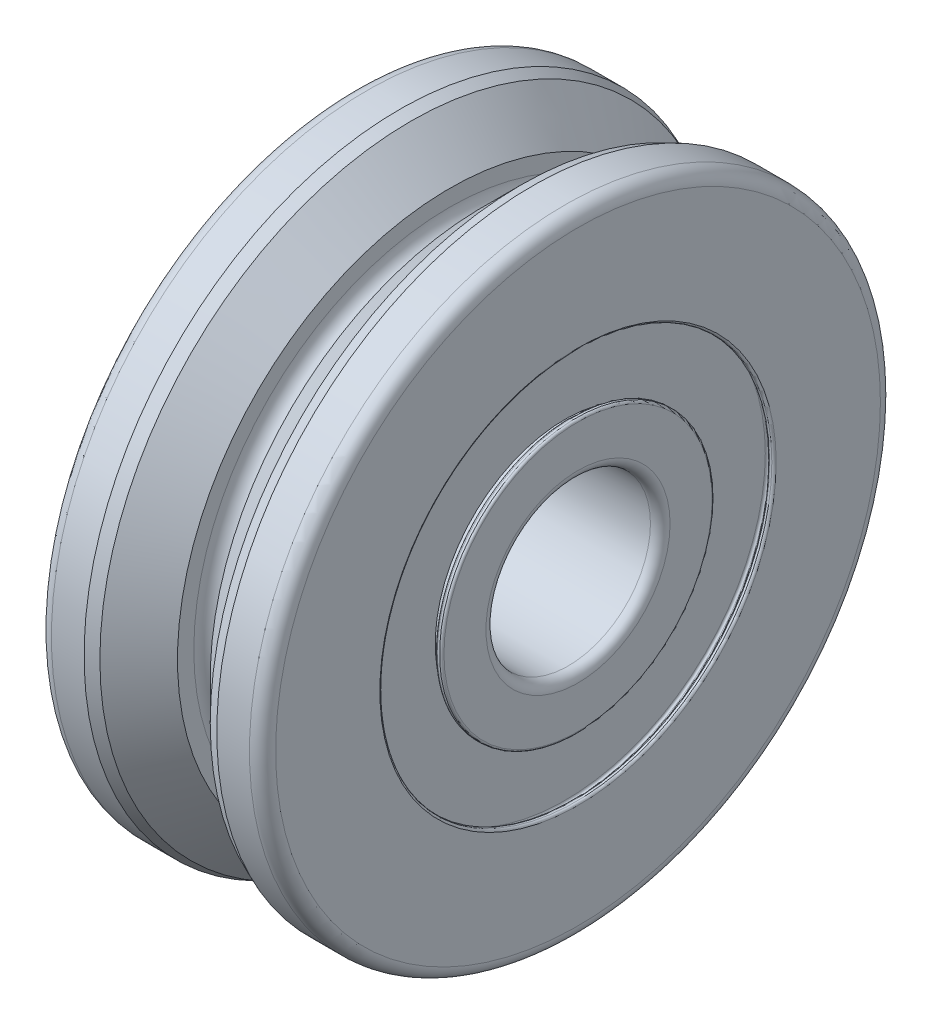
from build123d import *


with BuildPart() as part:
    # Sketch1 → Revolve1 (revolve)
    with BuildSketch(Plane.XY, mode=Mode.PRIVATE) as revolve1_sk:
        with BuildLine():
            Line((-3.4798, 4.161366666), (-3.4798, 2.8575))
            ThreePointArc((-3.4798, 2.8575), (-3.390526147, 2.641973853), (-3.175, 2.5527))
            Line((-3.175, 2.5527), (3.175, 2.5527))
            ThreePointArc((3.175, 2.5527), (3.390526147, 2.641973853), (3.4798, 2.8575))
            Line((3.4798, 2.8575), (3.4798, 4.161366666))
            ThreePointArc((3.4798, 4.161366666), (3.459961366, 4.209261365), (3.412066666, 4.2291))
            Line((3.412066666, 4.2291), (3.344333334, 4.2291))
            ThreePointArc((3.344333334, 4.2291), (3.296438634, 4.209261365), (3.2766, 4.161366666))
            Line((3.2766, 4.161366666), (3.2766, 4.0259))
            Line((3.2766, 4.0259), (3.0734, 4.0259))
            Line((3.0734, 4.0259), (3.0734, 6.218766666))
            ThreePointArc((3.0734, 6.218766666), (3.093238635, 6.266661366), (3.141133334, 6.2865))
            Line((3.141133334, 6.2865), (3.2766, 6.2865))
            Line((3.2766, 6.2865), (3.2766, 6.151033334))
            ThreePointArc((3.2766, 6.151033334), (3.296438634, 6.103138634), (3.344333334, 6.0833))
            Line((3.344333334, 6.0833), (3.412066666, 6.0833))
            ThreePointArc((3.412066666, 6.0833), (3.459961366, 6.103138634), (3.4798, 6.151033334))
            Line((3.4798, 6.151033334), (3.4798, 9.3853))
            ThreePointArc((3.4798, 9.3853), (3.360768196, 9.672668196), (3.0734, 9.7917))
            Line((3.0734, 9.7917), (2.059346048, 9.7917))
            Line((2.059346048, 9.7917), (1.71246195, 9.648015903))
            Line((1.71246195, 9.648015903), (0.507999999, 8.443553952))
            Line((0.507999999, 8.443553952), (0.507999999, 7.937500001))
            ThreePointArc((0.507999999, 7.937500001), (0, 7.429500002), (-0.507999999, 7.937500001))
            Line((-0.507999999, 7.937500001), (-0.507999999, 8.443553952))
            Line((-0.507999999, 8.443553952), (-1.71246195, 9.648015903))
            Line((-1.71246195, 9.648015903), (-2.059346048, 9.7917))
            Line((-2.059346048, 9.7917), (-3.0734, 9.7917))
            ThreePointArc((-3.0734, 9.7917), (-3.360768196, 9.672668196), (-3.4798, 9.3853))
            Line((-3.4798, 9.3853), (-3.4798, 6.151033334))
            ThreePointArc((-3.4798, 6.151033334), (-3.459961366, 6.103138634), (-3.412066666, 6.0833))
            Line((-3.412066666, 6.0833), (-3.344333333, 6.0833))
            ThreePointArc((-3.344333333, 6.0833), (-3.296438633, 6.103138634), (-3.276599999, 6.151033334))
            Line((-3.276599999, 6.151033334), (-3.276599999, 6.2865))
            Line((-3.276599999, 6.2865), (-3.141133332, 6.2865))
            ThreePointArc((-3.141133332, 6.2865), (-3.093238633, 6.266661366), (-3.073399999, 6.218766666))
            Line((-3.073399999, 6.218766666), (-3.073399999, 4.0259))
            Line((-3.073399999, 4.0259), (-3.276599999, 4.0259))
            Line((-3.276599999, 4.0259), (-3.276599999, 4.161366666))
            ThreePointArc((-3.276599999, 4.161366666), (-3.296438633, 4.209261365), (-3.344333333, 4.2291))
            Line((-3.344333333, 4.2291), (-3.412066666, 4.2291))
            ThreePointArc((-3.412066666, 4.2291), (-3.459961366, 4.209261365), (-3.4798, 4.161366666))
        make_face()
    revolve(revolve1_sk.sketch.rotate(Axis((-3.479800001, 0, 0), (1, 0, 0)), 270), axis=Axis((-3.479800001, 0, 0), (1, 0, 0)))


solid = part.part
